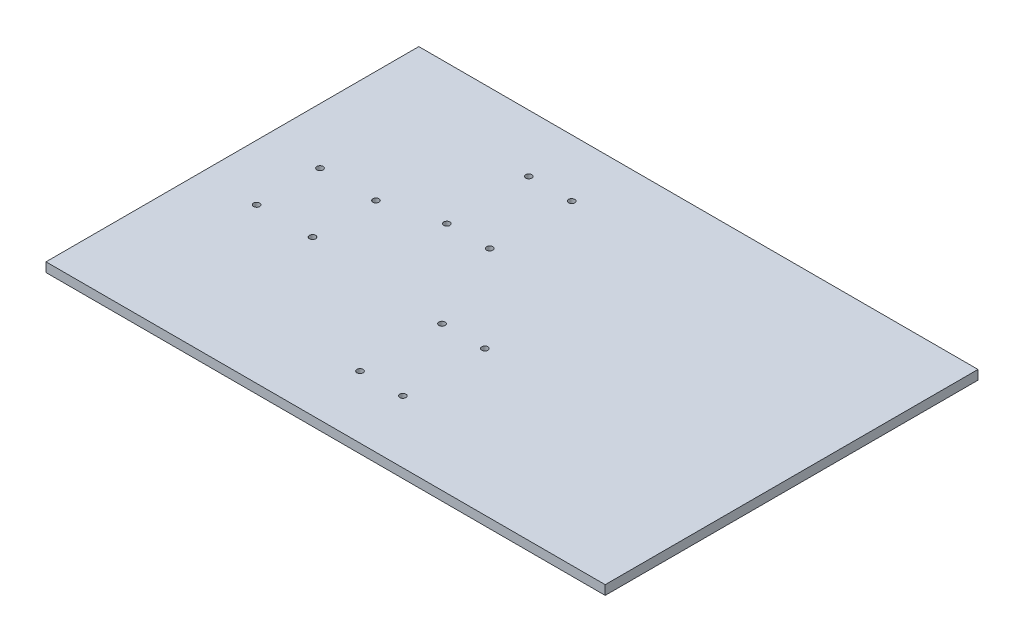
from build123d import *

# Parameters (mm, degrees)
SKETCH_2_W               = 240.549430728
SKETCH_2_H               = 149.540933388
EXTRUDE_1_DEPTH          = 5
SKETCH_6_W               = 93.246571425
SKETCH_6_H               = 149.540933388
EXTRUDE_4_DEPTH          = 5
SKETCH_8_W               = 274.716709757
SKETCH_8_H               = 58.51354913
EXTRUDE_6_DEPTH          = 5
CUT_EXTRUDE_2_DEPTH      = 252.755772101
CUT_EXTRUDE_2_DEPTH_BACK = 252.755772101
SKETCH_9_W               = 59.079292396
SKETCH_9_H               = 149.540933388
SKETCH_10_W              = 104.703380117
SKETCH_10_H              = 208.054482518
CUT_EXTRUDE_3_DEPTH      = 10
SKETCH_12_W              = 200
SKETCH_12_H              = 200
EXTRUDE_7_DEPTH          = 5
SKETCH_13_OUTSIDE_W      = 259.728
SKETCH_13_OUTSIDE_H      = 267.782
SKETCH_13_OUTSIDE_W_2    = 200
SKETCH_13_OUTSIDE_H_2    = 200
CUT_EXTRUDE_4_DEPTH      = 278.64321362
EXTRUDE_START            = -75
SKETCH_18_R              = 5.25
EXTRUDE_9_DEPTH          = 10
EXTRUDE_START_2          = -46
EXTRUDE_10_DEPTH         = 15
EXTRUDE_START_3          = -91.2
EXTRUDE_11_DEPTH         = 15
EXTRUDE_12_REACH         = 307.894
SKETCH_20_R              = 5.25
SKETCH_26_W              = 200
SKETCH_26_H              = 5
EXTRUDE_13_DEPTH         = 100
SKETCH_27_W              = 200
SKETCH_27_H              = 5
CUT_EXTRUDE_5_DEPTH      = 30
EXTRUDE_14_DEPTH         = 10
SKETCH_29_W              = 60
SKETCH_29_H              = 9
EXTRUDE_15_DEPTH         = 10
HOLE_WIZARD_M4_1_D       = 3.3
HOLE_WIZARD_M4_2_D       = 3.3
HOLE_WIZARD_M4_3_D       = 3.3
EXTRUDE_16_DEPTH         = 10
SKETCH_37_W              = 60
SKETCH_37_H              = 9
EXTRUDE_17_DEPTH         = 10
HOLE_WIZARD_M4_4_D       = 3.3
EXTRUDE_START_4          = -3.5
SKETCH_40_R              = 5.25
SKETCH_40_R_2            = 3.25
EXTRUDE_18_DEPTH         = 46.5
CUT_EXTRUDE_START        = -3.5
SKETCH_41_R              = 5.25
SKETCH_41_R_2            = 3.25
CUT_EXTRUDE_6_DEPTH      = 3.5
HOLE_WIZARD_M4_5_D       = 3.3
SKETCH_44_W              = 237.08727287
SKETCH_44_H              = 162.445626336
CUT_EXTRUDE_7_DEPTH      = 400.170489639
SKETCH_45_W              = 200
SKETCH_45_H              = 5
EXTRUDE_19_DEPTH         = 30


with BuildPart() as part:
    # 草图2 → 凸台-拉伸1 (new body)
    with BuildSketch(Plane(origin=(0, 0, 0), x_dir=(1, 0, 0), z_dir=(0, 1, 0))):
        Rectangle(SKETCH_2_W, SKETCH_2_H)
    extrude(amount=EXTRUDE_1_DEPTH)

    # 草图6 → 凸台-拉伸4 (add)
    with BuildSketch(Plane(origin=(0, 5, 0), x_dir=(1, 0, 0), z_dir=(0, 1, 0))):
        with Locations((166.898001077, 0)):
            Rectangle(SKETCH_6_W, SKETCH_6_H)
    extrude(amount=-EXTRUDE_4_DEPTH)

    # 草图8 → 凸台-拉伸6 (add)
    with BuildSketch(Plane(origin=(0, 5, 0), x_dir=(1, 0, 0), z_dir=(0, 1, 0))):
        with Locations((76.162931911, -104.027241259)):
            Rectangle(SKETCH_8_W, SKETCH_8_H)
    extrude(amount=-EXTRUDE_6_DEPTH)

    # 草图9 → 切除-拉伸2 (cut, two sides: drawn at the far end of the back side and taken through both)
    with BuildSketch(Plane(origin=(0, 5, 0), x_dir=(1, 0, 0), z_dir=(0, 1, 0)).offset(-CUT_EXTRUDE_2_DEPTH_BACK)):
        with Locations((-90.735069166, 0)):
            Rectangle(SKETCH_9_W, SKETCH_9_H)
    extrude(amount=CUT_EXTRUDE_2_DEPTH + CUT_EXTRUDE_2_DEPTH_BACK, mode=Mode.SUBTRACT)

    # 草图10 → 切除-拉伸3 (cut)
    with BuildSketch(Plane(origin=(0, 5, 0), x_dir=(1, 0, 0), z_dir=(0, 1, 0))):
        with Locations((-8.84373291, -29.256774565)):
            Rectangle(SKETCH_10_W, SKETCH_10_H)
    extrude(amount=-CUT_EXTRUDE_3_DEPTH, mode=Mode.SUBTRACT)

    # 草图12 → 凸台-拉伸7 (add)
    with BuildSketch(Plane(origin=(0, 5, 0), x_dir=(1, 0, 0), z_dir=(0, 1, 0))):
        with Locations((143.507957149, -25.229533306)):
            Rectangle(SKETCH_12_W, SKETCH_12_H)
    extrude(amount=-EXTRUDE_7_DEPTH)

    # 草图13 outside → 切除-拉伸4 (cut, through all)
    with BuildSketch(Plane(origin=(0, 5, 0), x_dir=(1, 0, 0), z_dir=(0, 1, 0))):
        with Locations((143.508, -29.257)):
            Rectangle(SKETCH_13_OUTSIDE_W, SKETCH_13_OUTSIDE_H)
        with Locations((143.507957149, -25.229533306)):
            Rectangle(SKETCH_13_OUTSIDE_W_2, SKETCH_13_OUTSIDE_H_2, mode=Mode.SUBTRACT)
    extrude(amount=-CUT_EXTRUDE_4_DEPTH, mode=Mode.SUBTRACT)

    # 草图18 → 凸台-拉伸9 (add)
    with BuildSketch(Plane.XY.offset(125.229533306).offset(EXTRUDE_START)):
        with BuildLine():
            Line((95.507957149, 14), (95.507957149, 125))
            ThreePointArc((95.507957149, 125), (88.507957149, 132), (81.507957149, 125))
            Line((81.507957149, 125), (81.507957149, 14))
            Line((81.507957149, 14), (68.507957149, 14))
            Line((68.507957149, 14), (68.507957149, 5))
            Line((68.507957149, 5), (108.507957149, 5))
            Line((108.507957149, 5), (108.507957149, 14))
            Line((108.507957149, 14), (95.507957149, 14))
        make_face()
        with Locations((88.507957149, 125)):
            Circle(SKETCH_18_R, mode=Mode.SUBTRACT)
    extrude_9 = extrude(amount=-EXTRUDE_9_DEPTH)

    # 镜向1: 凸台-拉伸9 across plane
    add(extrude_9.mirror(Plane.XY.offset(25.229533306)))

    # 草图16 → 凸台-拉伸10 (add)
    with BuildSketch(Plane(origin=(243.507957149, 0, 0), x_dir=(0, 0, -1), z_dir=(1, 0, 0)).offset(EXTRUDE_START_2)):
        with BuildLine():
            Line((-53.779533306, 14), (-53.779533306, 145.085631965))
            Line((-53.779533306, 145.085631965), (-67.779533306, 145.085631965))
            Line((-67.779533306, 145.085631965), (-67.779533306, 139.085631965))
            ThreePointArc((-67.779533306, 139.085631965), (-69.779533306, 114.75), (-71.779533306, 139.085631965))
            Line((-71.779533306, 139.085631965), (-71.779533306, 145.085631965))
            Line((-71.779533306, 145.085631965), (-85.779533306, 145.085631965))
            Line((-85.779533306, 145.085631965), (-85.779533306, 14))
            Line((-85.779533306, 14), (-99.779533306, 14))
            Line((-99.779533306, 14), (-99.779533306, 5))
            Line((-99.779533306, 5), (-39.779533306, 5))
            Line((-39.779533306, 5), (-39.779533306, 14))
            Line((-39.779533306, 14), (-53.779533306, 14))
        make_face()
    extrude(amount=-EXTRUDE_10_DEPTH)

    # 草图19 → 凸台-拉伸11 (add)
    with BuildSketch(Plane(origin=(243.507957149, 0, 0), x_dir=(0, 0, -1), z_dir=(1, 0, 0)).offset(EXTRUDE_START_3)):
        with BuildLine():
            Line((37.990466694, 14), (37.990466694, 144.933566106))
            Line((37.990466694, 144.933566106), (23.990466694, 144.933566106))
            Line((23.990466694, 144.933566106), (23.990466694, 138.933566106))
            ThreePointArc((23.990466694, 138.933566106), (21.990466694, 114.9), (19.990466694, 138.933566106))
            Line((19.990466694, 138.933566106), (19.990466694, 144.933566106))
            Line((19.990466694, 144.933566106), (5.990466694, 144.933566106))
            Line((5.990466694, 144.933566106), (5.990466694, 14))
            Line((5.990466694, 14), (-8.009533306, 14))
            Line((-8.009533306, 14), (-8.009533306, 5))
            Line((-8.009533306, 5), (51.990466694, 5))
            Line((51.990466694, 5), (51.990466694, 14))
            Line((51.990466694, 14), (37.990466694, 14))
        make_face()
    extrude(amount=-EXTRUDE_11_DEPTH)

    # 草图20 → 凸台-拉伸12 (add, up to next)
    with BuildSketch(Plane(origin=(0, 0, 40.229533306), x_dir=(-1, 0, 0), z_dir=(0, 0, -1)), mode=Mode.PRIVATE) as extrude_12_sk1:
        with BuildLine():
            Line((-108.507957149, 5), (-68.507957149, 5))
            Line((-68.507957149, 5), (-68.507957149, 14))
            Line((-68.507957149, 14), (-81.507957149, 14))
            Line((-81.507957149, 14), (-81.507957149, 125))
            ThreePointArc((-81.507957149, 125), (-88.507957149, 132), (-95.507957149, 125))
            Line((-95.507957149, 125), (-95.507957149, 14))
            Line((-95.507957149, 14), (-108.507957149, 14))
            Line((-108.507957149, 14), (-108.507957149, 5))
        make_face()
        with Locations(Location((-88.507957149, 125, 0), (0, 0, 180))):
            Circle(SKETCH_20_R, mode=Mode.SUBTRACT)
    extrude_12_tool1 = extrude(extrude_12_sk1.sketch, amount=EXTRUDE_12_REACH, mode=Mode.PRIVATE) - part.part
    add(extrude_12_tool1.solids().sort_by_distance((88.507957, 57.997401, 40.229533))[0])

    # 草图26 → 凸台-拉伸13 (add)
    with BuildSketch(Plane(origin=(243.507957149, 0, 0), x_dir=(0, 0, -1), z_dir=(1, 0, 0))):
        with Locations((-25.229533306, 2.5)):
            Rectangle(SKETCH_26_W, SKETCH_26_H)
    extrude(amount=EXTRUDE_13_DEPTH)

    # 草图27 → 切除-拉伸5 (cut)
    with BuildSketch(Plane(origin=(343.507957149, 0, 0), x_dir=(0, 0, -1), z_dir=(1, 0, 0))):
        with Locations((-25.229533306, 2.5)):
            Rectangle(SKETCH_27_W, SKETCH_27_H)
    extrude(amount=-CUT_EXTRUDE_5_DEPTH, mode=Mode.SUBTRACT)

    # 草图28 → 凸台-拉伸14 (add)
    with BuildSketch(Plane(origin=(197.507957149, 0, 0), x_dir=(0, 0, -1), z_dir=(1, 0, 0))):
        Polygon((-85.779533306, 14), (-53.779533306, 14), (-39.779533306, 14), (-39.779533306, 5), (-99.779533306, 5), (-99.779533306, 14), align=None)
    extrude(amount=EXTRUDE_14_DEPTH)

    # 草图29 → 凸台-拉伸15 (add)
    with BuildSketch(Plane.ZY.offset(-182.507957149)):
        with Locations((69.779533306, 9.5)):
            Rectangle(SKETCH_29_W, SKETCH_29_H)
    extrude(amount=EXTRUDE_15_DEPTH)

    # M4 螺纹孔1 (through all)
    with Locations(Plane(origin=(0, 14, 0), x_dir=(1, 0, 0), z_dir=(0, 1, 0))):
        with Locations((178.507957149, -47.779533306), (201.507957149, -47.779533306), (201.507957149, -91.779533306), (178.507957149, -91.779533306)):
            Hole(HOLE_WIZARD_M4_1_D / 2)

    # M4 螺纹孔2 (through all)
    with Locations(Plane.XY.offset(85.779533306)):
        with Locations((190.007957149, 141.085631965)):
            Hole(HOLE_WIZARD_M4_2_D / 2)

    # M4 螺纹孔3 (through all)
    with Locations(Plane.XY.offset(-5.990466694)):
        with Locations((144.807957149, 140.933566106)):
            Hole(HOLE_WIZARD_M4_3_D / 2)

    # 草图36 → 凸台-拉伸16 (add)
    with BuildSketch(Plane(origin=(152.307957149, 0, 0), x_dir=(0, 0, -1), z_dir=(1, 0, 0))):
        Polygon((5.990466694, 14), (37.990466694, 14), (51.990466694, 14), (51.990466694, 5), (-8.009533306, 5), (-8.009533306, 14), align=None)
    extrude(amount=EXTRUDE_16_DEPTH)

    # 草图37 → 凸台-拉伸17 (add)
    with BuildSketch(Plane.ZY.offset(-137.307957149)):
        with Locations((-21.990466694, 9.5)):
            Rectangle(SKETCH_37_W, SKETCH_37_H)
    extrude(amount=EXTRUDE_17_DEPTH)

    # M4 螺纹孔4 (through all)
    with Locations(Plane(origin=(0, 14, 0), x_dir=(1, 0, 0), z_dir=(0, 1, 0))):
        with Locations((133.307957149, 43.990466694), (156.307957149, 43.990466694), (156.307957149, -0.009533306), (133.307957149, -0.009533306)):
            Hole(HOLE_WIZARD_M4_4_D / 2)

    # 草图40 → 凸台-拉伸18 (add)
    with BuildSketch(Plane.XY.offset(50.229533306).offset(EXTRUDE_START_4)):
        with Locations((88.507957149, 125)):
            Circle(SKETCH_40_R)
        with Locations((88.507957149, 125)):
            Circle(SKETCH_40_R_2, mode=Mode.SUBTRACT)
    extrude(amount=-EXTRUDE_18_DEPTH)

    # 草图41 → 切除-拉伸6 (cut)
    with BuildSketch(Plane(origin=(0, 0, 0.229533306), x_dir=(-1, 0, 0), z_dir=(0, 0, -1)).offset(CUT_EXTRUDE_START)):
        with Locations(Location((-88.507957149, 125, 0), (0, 0, 180))):
            Circle(SKETCH_41_R)
        with Locations(Location((-88.507957149, 125, 0), (0, 0, 180))):
            Circle(SKETCH_41_R_2, mode=Mode.SUBTRACT)
    extrude(amount=CUT_EXTRUDE_6_DEPTH, mode=Mode.SUBTRACT)

    # M4 螺纹孔5 (through all)
    with Locations(Plane(origin=(0, 14, 0), x_dir=(1, 0, 0), z_dir=(0, 1, 0))):
        with Locations((73.507957149, -8.229533306), (103.507957149, -8.229533306), (103.507957149, -42.229533306), (73.507957149, -42.229533306)):
            Hole(HOLE_WIZARD_M4_5_D / 2)

    # 草图44 → 切除-拉伸7 (cut, through all)
    with BuildSketch(Plane.XY.offset(125.229533306)):
        with Locations((150.88727092, 86.222813168)):
            Rectangle(SKETCH_44_W, SKETCH_44_H)
    extrude(amount=-CUT_EXTRUDE_7_DEPTH, mode=Mode.SUBTRACT)

    # 草图45 → 凸台-拉伸19 (add)
    with BuildSketch(Plane(origin=(313.507957149, 0, 0), x_dir=(0, 0, -1), z_dir=(1, 0, 0))):
        with Locations((-25.229533306, 2.5)):
            Rectangle(SKETCH_45_W, SKETCH_45_H)
    extrude(amount=EXTRUDE_19_DEPTH)


solid = part.part
